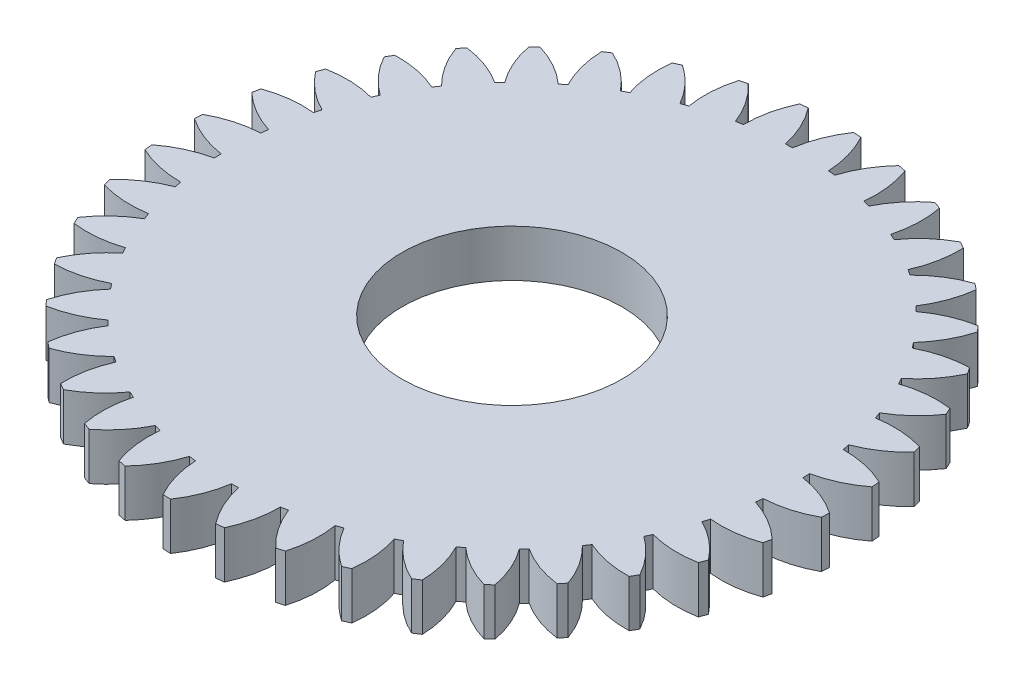
from build123d import *

# Parameters (mm, degrees)
CROQUIS2_R              = 10.5
CROQUIS2_R_2            = 3.5
SALIENTE_EXTRUIR1_DEPTH = 1.5
CORTAR_EXTRUIR1_DEPTH   = 16
MATRIZC1_COUNT          = 40


with BuildPart() as part:
    # Croquis2 → Saliente-Extruir1 (new body)
    with BuildSketch(Plane(origin=(0, 0, 0), x_dir=(1, 0, 0), z_dir=(0, 1, 0))):
        with Locations(Location((0, 0, 0), (0, 0, 270))):
            Circle(CROQUIS2_R)
        with Locations(Location((0, 0, 0), (0, 0, 270))):
            Circle(CROQUIS2_R_2, mode=Mode.SUBTRACT)
    extrude(amount=SALIENTE_EXTRUIR1_DEPTH)

    # Croquis1 → Cortar-Extruir1 (cut)
    with BuildSketch(Plane(origin=(0, 0, 0), x_dir=(1, 0, 0), z_dir=(0, 1, 0))):
        with BuildLine():
            ThreePointArc((0.381809846, 10.493055858), (-0.318156309, 10.495178729), (-1.01670856, 10.450660443))
            ThreePointArc((-1.01670856, 10.450660443), (-0.624255204, 9.807078131), (-0.386377044, 9.091793705))
            ThreePointArc((-0.386377044, 9.091793705), (-0.275735468, 9.095821566), (-0.165053076, 9.098503035))
            ThreePointArc((-0.165053076, 9.098503035), (0.029061087, 9.826883101), (0.381809846, 10.493055858))
        make_face()
    cortar_extruir1 = extrude(amount=CORTAR_EXTRUIR1_DEPTH, mode=Mode.SUBTRACT)

    # MatrizC1: Cortar-Extruir1 ×40 about axis
    matrizc1_axis = Axis((0, 0, 0), (0, 1, 0))
    for i in range(1, MATRIZC1_COUNT):
        add(cortar_extruir1.rotate(matrizc1_axis, i * 360 / MATRIZC1_COUNT), mode=Mode.SUBTRACT)


solid = part.part
